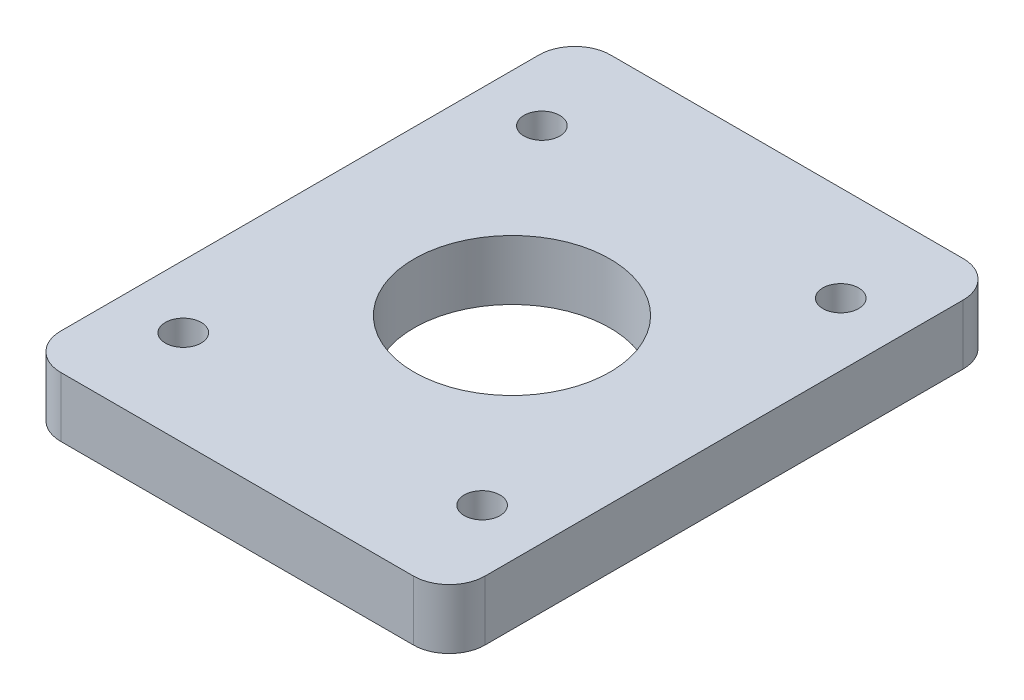
from build123d import *

# Parameters (mm, degrees)
SKETCH_1_W          = 35.5
SKETCH_1_H          = 46
SKETCH_1_R          = 8.2
EXTRUDE_1_DEPTH     = 5
FILLET_2_R          = 3
SKETCH_3_R          = 1.5
CUT_EXTRUDE_1_DEPTH = 10


with BuildPart() as part:
    # 草图1 → 凸台-拉伸1 (new body)
    with BuildSketch(Plane(origin=(0, 0, 0), x_dir=(1, 0, 0), z_dir=(0, 1, 0))):
        with Locations((0, 7.25)):
            Rectangle(SKETCH_1_W, SKETCH_1_H)
        with Locations(Location((0, 7.25, 0), (0, 0, 270))):
            Circle(SKETCH_1_R, mode=Mode.SUBTRACT)
    extrude(amount=EXTRUDE_1_DEPTH)

    # 圆角2
    fillet_2_edges = [part.edges().sort_by_distance(p)[0] for p in [
        (-17.75, 2.5, -30.25),
        (17.75, 2.5, -30.25),
        (17.75, 2.5, 15.75),
        (-17.75, 2.5, 15.75),
    ]]
    fillet(fillet_2_edges, radius=FILLET_2_R)

    # 草图3 → 切除-拉伸1 (cut)
    with BuildSketch(Plane.XZ):
        with Locations(Location((-12.5, 7.75, 0), (0, 0, 270))):
            Circle(SKETCH_3_R)
        with Locations(Location((12.5, 7.75, 0), (0, 0, 270))):
            Circle(SKETCH_3_R)
        with Locations(Location((12.5, -22.25, 0), (0, 0, 270))):
            Circle(SKETCH_3_R)
        with Locations(Location((-12.5, -22.25, 0), (0, 0, 270))):
            Circle(SKETCH_3_R)
    extrude(amount=-CUT_EXTRUDE_1_DEPTH, mode=Mode.SUBTRACT)


solid = part.part
